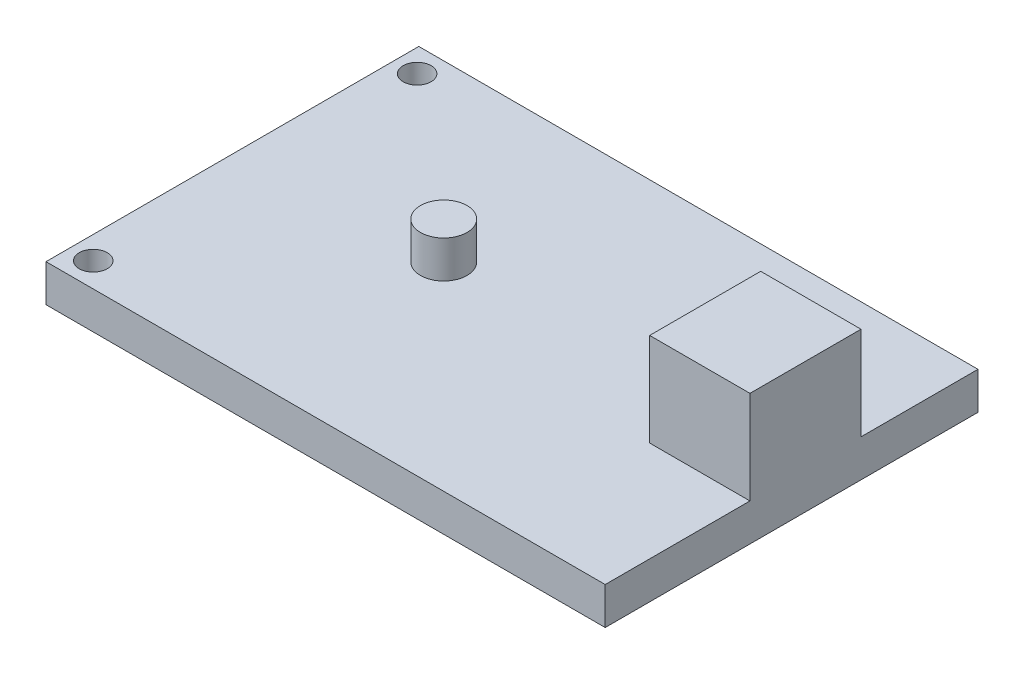
from build123d import *

# Parameters (mm, degrees)
ESQUISSE1_W             = 30
ESQUISSE1_H             = 20
BOSS_EXTRU_1_DEPTH      = 2
ESQUISSE2_R             = 0.75
ENL_V_MAT_EXTRU_1_DEPTH = 2
ESQUISSE3_R             = 1.25
BOSS_EXTRU_2_DEPTH      = 2
ESQUISSE4_W             = 5.380750915
ESQUISSE4_H             = 5.957728466
BOSS_EXTRU_3_DEPTH      = 5


with BuildPart() as part:
    # Esquisse1 → Boss.-Extru.1 (new body)
    with BuildSketch(Plane(origin=(0, 0, 0), x_dir=(1, 0, 0), z_dir=(0, 1, 0))):
        Rectangle(ESQUISSE1_W, ESQUISSE1_H)
    extrude(amount=BOSS_EXTRU_1_DEPTH)

    # Esquisse2 → Enlèv. mat.-Extru.1 (cut)
    with BuildSketch(Plane(origin=(0, 2, 0), x_dir=(1, 0, 0), z_dir=(0, 1, 0))):
        with Locations(Location((-13.777247076, -8.688354012, 0), (0, 0, 270))):
            Circle(ESQUISSE2_R)
    enl_v_mat_extru_1 = extrude(amount=-ENL_V_MAT_EXTRU_1_DEPTH, mode=Mode.SUBTRACT)

    # Symétrie1: Enlèv. mat.-Extru.1 across plane
    add(enl_v_mat_extru_1.mirror(Plane.XY), mode=Mode.SUBTRACT)

    # Esquisse3 → Boss.-Extru.2 (add)
    with BuildSketch(Plane(origin=(0, 2, 0), x_dir=(1, 0, 0), z_dir=(0, 1, 0))):
        with Locations(Location((-4.31314717, 0.651626551, 0), (0, 0, 270))):
            Circle(ESQUISSE3_R)
    extrude(amount=BOSS_EXTRU_2_DEPTH)

    # Esquisse4 → Boss.-Extru.3 (add)
    with BuildSketch(Plane(origin=(0, 2, 0), x_dir=(1, 0, 0), z_dir=(0, 1, 0))):
        with Locations((12.309624542, 0.744716058)):
            Rectangle(ESQUISSE4_W, ESQUISSE4_H)
    extrude(amount=BOSS_EXTRU_3_DEPTH)


solid = part.part
